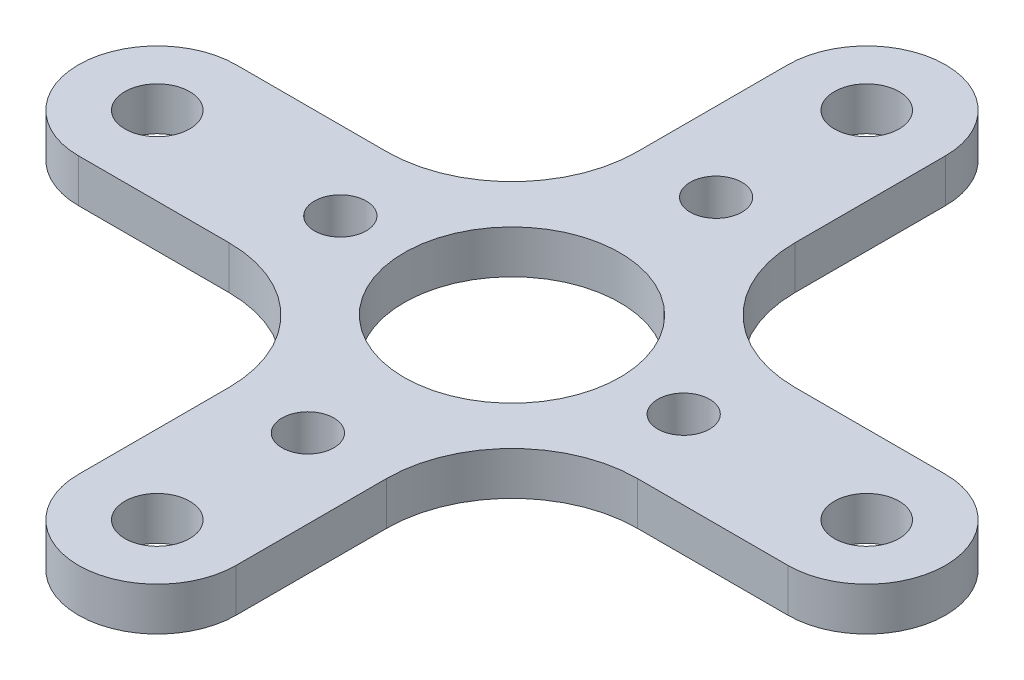
from build123d import *

# Parameters (mm, degrees)
SKETCH1_R      = 1.5
SKETCH1_R_2    = 1.2
SKETCH1_R_3    = 5
EXTRUDE1_DEPTH = 2


with BuildPart() as part:
    # Sketch1 → Extrude1 (new body)
    with BuildSketch(Plane(origin=(0, 0, 0), x_dir=(1, 0, 0), z_dir=(0, 1, 0))):
        with BuildLine():
            Line((-1.80734609, 20.125232899), (-8.78234609, 20.125232899))
            ThreePointArc((-8.78234609, 20.125232899), (-12.883565421, 18.42645223), (-14.58234609, 14.325232899))
            Line((-14.58234609, 14.325232899), (-14.58234609, 7.350232899))
            ThreePointArc((-14.58234609, 7.350232899), (-18.23234609, 3.700232899), (-21.88234609, 7.350232899))
            Line((-21.88234609, 7.350232899), (-21.88234609, 14.325232899))
            ThreePointArc((-21.88234609, 14.325232899), (-23.581126759, 18.42645223), (-27.68234609, 20.125232899))
            Line((-27.68234609, 20.125232899), (-34.65734609, 20.125232899))
            ThreePointArc((-34.65734609, 20.125232899), (-38.30734609, 23.775232899), (-34.65734609, 27.425232899))
            Line((-34.65734609, 27.425232899), (-27.68234609, 27.425232899))
            ThreePointArc((-27.68234609, 27.425232899), (-23.581126759, 29.124013568), (-21.88234609, 33.225232899))
            Line((-21.88234609, 33.225232899), (-21.88234609, 40.200232899))
            ThreePointArc((-21.88234609, 40.200232899), (-18.23234609, 43.850232899), (-14.58234609, 40.200232899))
            Line((-14.58234609, 40.200232899), (-14.58234609, 33.225232899))
            ThreePointArc((-14.58234609, 33.225232899), (-12.883565421, 29.124013568), (-8.78234609, 27.425232899))
            Line((-8.78234609, 27.425232899), (-1.80734609, 27.425232899))
            ThreePointArc((-1.80734609, 27.425232899), (1.84265391, 23.775232899), (-1.80734609, 20.125232899))
        make_face()
        with Locations(Location((-18.23234609, 40.200232899, 0), (0, 0, 270))):
            Circle(SKETCH1_R, mode=Mode.SUBTRACT)
        with Locations(Location((-18.23234609, 7.350232899, 0), (0, 0, 270))):
            Circle(SKETCH1_R, mode=Mode.SUBTRACT)
        with Locations(Location((-34.65734609, 23.775232899, 0), (0, 0, 270))):
            Circle(SKETCH1_R, mode=Mode.SUBTRACT)
        with Locations(Location((-1.80734609, 23.775232899, 0), (0, 0, 270))):
            Circle(SKETCH1_R, mode=Mode.SUBTRACT)
        with Locations(Location((-26.18234609, 23.775232899, 0), (0, 0, 270))):
            Circle(SKETCH1_R_2, mode=Mode.SUBTRACT)
        with Locations(Location((-10.28234609, 23.775232899, 0), (0, 0, 270))):
            Circle(SKETCH1_R_2, mode=Mode.SUBTRACT)
        with Locations(Location((-18.23234609, 33.225232899, 0), (0, 0, 270))):
            Circle(SKETCH1_R_2, mode=Mode.SUBTRACT)
        with Locations(Location((-18.23234609, 14.325232899, 0), (0, 0, 270))):
            Circle(SKETCH1_R_2, mode=Mode.SUBTRACT)
        with Locations(Location((-18.23234609, 23.775232899, 0), (0, 0, 270))):
            Circle(SKETCH1_R_3, mode=Mode.SUBTRACT)
    extrude(amount=EXTRUDE1_DEPTH)


solid = part.part
